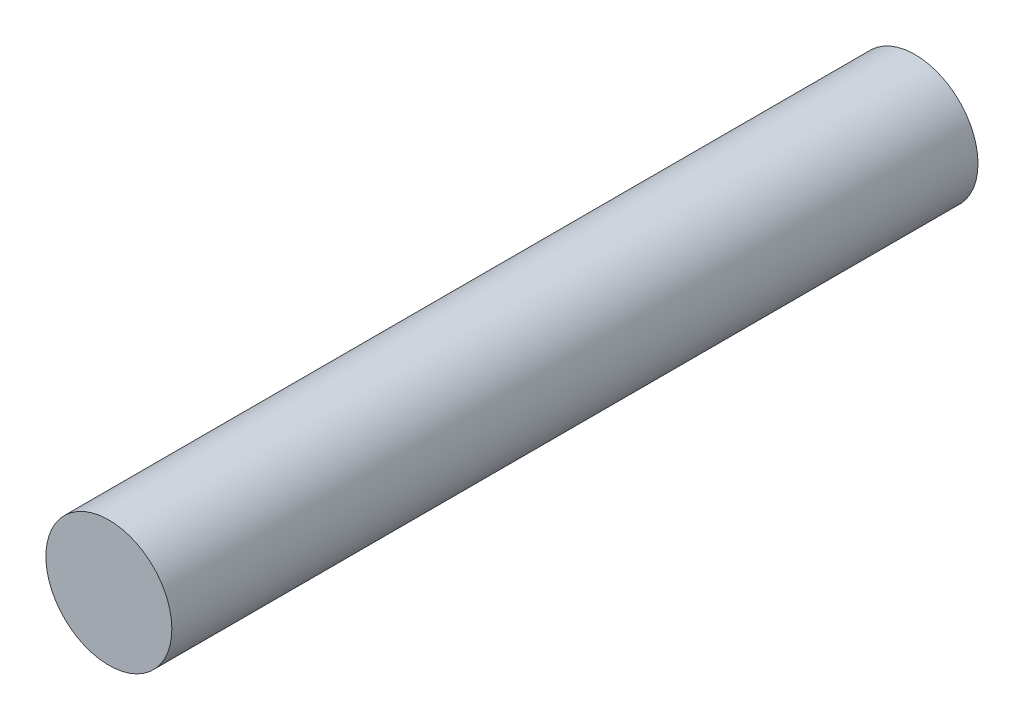
from build123d import *

# Parameters (mm, degrees)
SKETCH1_R           = 2.5
BOSS_EXTRUDE1_DEPTH = 32


with BuildPart() as part:
    # Sketch1 → Boss-Extrude1 (new body)
    with BuildSketch(Plane.XY):
        Circle(SKETCH1_R)
    extrude(amount=BOSS_EXTRUDE1_DEPTH)


solid = part.part
